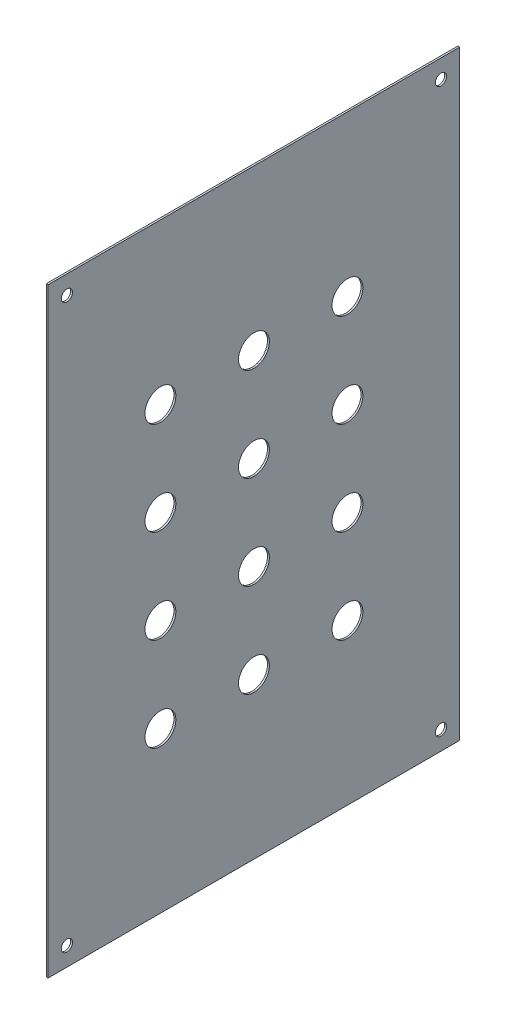
from build123d import *

# Parameters (mm, degrees)
SKETCH1_W           = 321
SKETCH1_H           = 220
BOSS_EXTRUDE1_DEPTH = 1
SKETCH2_R           = 8.25
CUT_EXTRUDE1_DEPTH  = 195.579675198
SKETCH3_R           = 3
CUT_EXTRUDE2_DEPTH  = 195.579675198


with BuildPart() as part:
    # Sketch1 → Boss-Extrude1 (new body)
    with BuildSketch(Plane.YZ):
        Rectangle(SKETCH1_W, SKETCH1_H)
    extrude(amount=BOSS_EXTRUDE1_DEPTH)

    # Sketch2 → Cut-Extrude1 (cut, through all)
    with BuildSketch(Plane.YZ.offset(1)):
        with Locations(Location((-75, 50, 0), (0, 0, 270))):
            Circle(SKETCH2_R)
        with Locations(Location((-25, 50, 0), (0, 0, 270))):
            Circle(SKETCH2_R)
        with Locations(Location((25, 50, 0), (0, 0, 270))):
            Circle(SKETCH2_R)
        with Locations(Location((75, 50, 0), (0, 0, 270))):
            Circle(SKETCH2_R)
        with Locations(Location((-25, 0, 0), (0, 0, 270))):
            Circle(SKETCH2_R)
        with Locations(Location((25, 0, 0), (0, 0, 270))):
            Circle(SKETCH2_R)
        with Locations(Location((75, 0, 0), (0, 0, 270))):
            Circle(SKETCH2_R)
        with Locations(Location((-25, -50, 0), (0, 0, 270))):
            Circle(SKETCH2_R)
        with Locations(Location((25, -50, 0), (0, 0, 270))):
            Circle(SKETCH2_R)
        with Locations(Location((75, -50, 0), (0, 0, 270))):
            Circle(SKETCH2_R)
        with Locations(Location((-75, 0, 0), (0, 0, 270))):
            Circle(SKETCH2_R)
        with Locations(Location((-75, -50, 0), (0, 0, 270))):
            Circle(SKETCH2_R)
    extrude(amount=-CUT_EXTRUDE1_DEPTH, mode=Mode.SUBTRACT)

    # Sketch3 → Cut-Extrude2 (cut, through all)
    with BuildSketch(Plane.YZ.offset(1)):
        with Locations(Location((-150.5, 100, 0), (0, 0, 270))):
            Circle(SKETCH3_R)
        with Locations(Location((150.5, 100, 0), (0, 0, 90))):
            Circle(SKETCH3_R)
        with Locations(Location((-150.5, -100, 0), (0, 0, 90))):
            Circle(SKETCH3_R)
        with Locations(Location((150.5, -100, 0), (0, 0, 270))):
            Circle(SKETCH3_R)
    extrude(amount=-CUT_EXTRUDE2_DEPTH, mode=Mode.SUBTRACT)


solid = part.part
